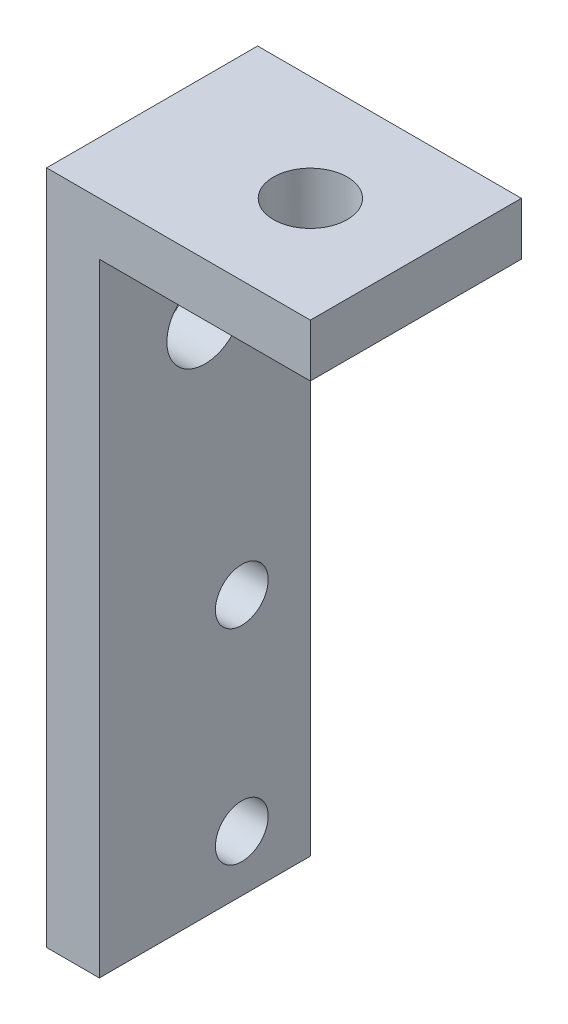
from build123d import *

# Parameters (mm, degrees)
BOSS_EXTRUDE1_DEPTH = 10
SKETCH2_R           = 1.75
CUT_EXTRUDE1_DEPTH  = 10
SKETCH3_R           = 1.25
SKETCH3_R_2         = 1.8
CUT_EXTRUDE2_DEPTH  = 40.143965052
SKETCH4_W           = 13.022509218
SKETCH4_H           = 4.5
CUT_EXTRUDE3_DEPTH  = 40.143965052


with BuildPart() as part:
    # Sketch1 → Boss-Extrude1 (new body)
    with BuildSketch(Plane.XY):
        Polygon((0, 0), (0, 36.5), (12.5, 36.5), (12.5, 34), (2.5, 34), (2.5, 0), align=None)
    extrude(amount=BOSS_EXTRUDE1_DEPTH)

    # Sketch2 → Cut-Extrude1 (cut)
    with BuildSketch(Plane.XZ.offset(-34)):
        with Locations((7.5, 5)):
            Circle(SKETCH2_R)
    extrude(amount=-CUT_EXTRUDE1_DEPTH, mode=Mode.SUBTRACT)

    # Sketch3 → Cut-Extrude2 (cut, through all)
    with BuildSketch(Plane(origin=(2.5, 0, 0), x_dir=(0, 0, -1), z_dir=(1, 0, 0))):
        with Locations(Location((-3.25, 7.15, 0), (0, 0, 90))):
            Circle(SKETCH3_R)
        with Locations(Location((-3.25, 16.85, 0), (0, 0, 270))):
            Circle(SKETCH3_R)
        with Locations(Location((-5, 29, 0), (0, 0, 90))):
            Circle(SKETCH3_R_2)
    extrude(amount=-CUT_EXTRUDE2_DEPTH, mode=Mode.SUBTRACT)

    # Sketch4 → Cut-Extrude3 (cut, through all)
    with BuildSketch(Plane(origin=(2.5, 0, 0), x_dir=(0, 0, -1), z_dir=(1, 0, 0))):
        with Locations((-6.511254609, 2.25)):
            Rectangle(SKETCH4_W, SKETCH4_H)
    extrude(amount=-CUT_EXTRUDE3_DEPTH, mode=Mode.SUBTRACT)


solid = part.part
